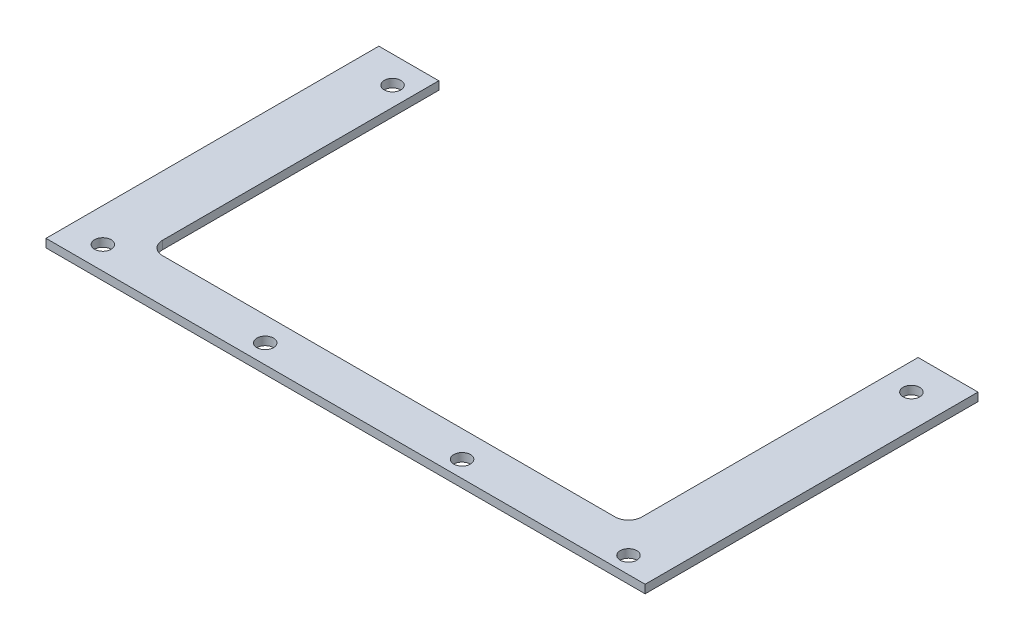
from build123d import *

# Parameters (mm, degrees)
SKETCH1_W                   = 12.7
SKETCH1_H                   = 127
BOSS_EXTRUDE1_DEPTH         = 3.175
F_1_4_0_25_DIAMETER_HOLE1_D = 6.35


with BuildPart() as part:
    # Sketch1 → Boss-Extrude1 (new body)
    with BuildSketch(Plane(origin=(0, 25.4, 0), x_dir=(1, 0, 0), z_dir=(0, 1, 0))):
        with BuildLine():
            Line((-91.44, 342.9), (-101.6, 342.9))
            Line((-101.6, 342.9), (-101.6, 215.9))
            Line((-101.6, 215.9), (98.425, 215.9))
            Line((98.425, 215.9), (101.6, 215.9))
            Line((101.6, 215.9), (101.6, 342.9))
            Line((101.6, 342.9), (91.44, 342.9))
            Line((91.44, 342.9), (91.44, 308.61))
            Line((91.44, 308.61), (91.44, 237.49))
            ThreePointArc((91.44, 237.49), (89.952102448, 233.897897552), (86.36, 232.41))
            Line((86.36, 232.41), (-86.36, 232.41))
            ThreePointArc((-86.36, 232.41), (-89.952102448, 233.897897552), (-91.44, 237.49))
            Line((-91.44, 237.49), (-91.44, 308.61))
            Line((-91.44, 308.61), (-91.44, 342.9))
        make_face()
        with Locations((-107.95, 279.4)):
            Rectangle(SKETCH1_W, SKETCH1_H)
        with Locations((107.95, 279.4)):
            Rectangle(SKETCH1_W, SKETCH1_H)
    extrude(amount=BOSS_EXTRUDE1_DEPTH)

    # 1/4 (0.25) Diameter Hole1 (through all)
    with Locations(Plane(origin=(0, 28.575, 0), x_dir=(1, 0, 0), z_dir=(0, 1, 0))):
        with Locations((101.6, 330.2), (101.6, 222.25), (38.1, 222.25), (-98.802463558, 332.626703007), (-101.416445229, 224.708356097), (-37.935064693, 223.17071982)):
            Hole(F_1_4_0_25_DIAMETER_HOLE1_D / 2)


solid = part.part
